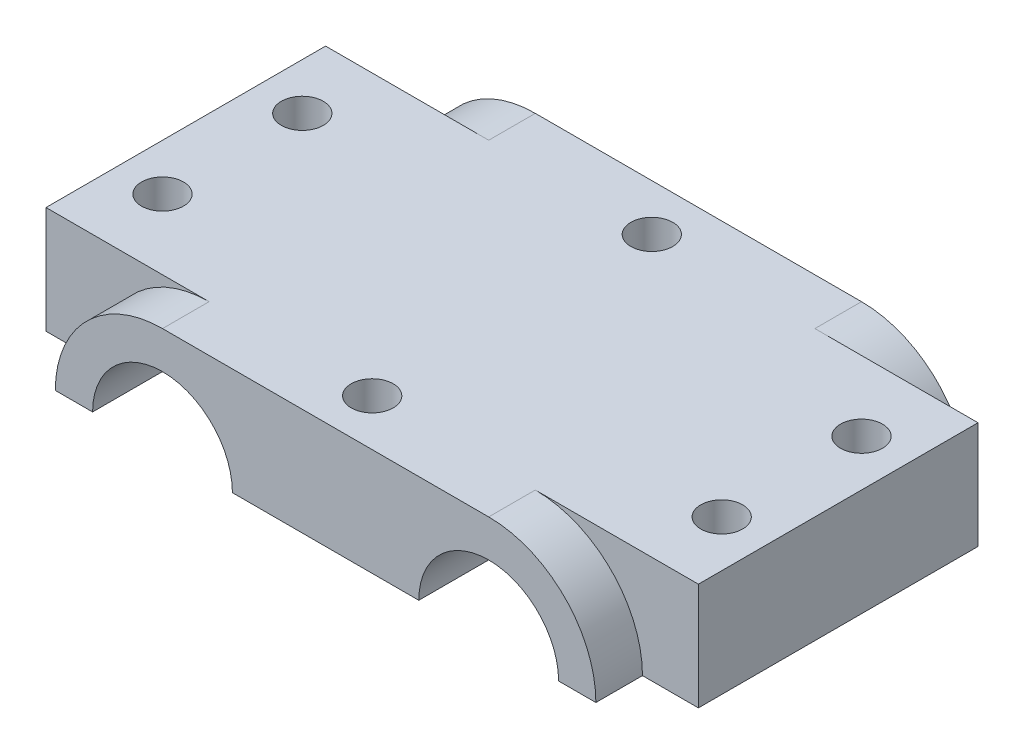
from build123d import *

# Parameters (mm, degrees)
SKETCH1_W            = 70
SKETCH1_H            = 11.5
BOSS_EXTRUDE1_DEPTH  = 20
CUT_EXTRUDE1_REACH   = 55.461
CUT_EXTRUDE2_DEPTH   = 5
HOLE1_D              = 4.5
LPATTERN1_COUNT      = 2
LPATTERN1_PITCH      = 60
LPATTERN1_COUNT_DIR2 = 2
LPATTERN1_PITCH_DIR2 = 15
HOLE2_D              = 4.5


with BuildPart() as part:
    # Sketch1 → Boss-Extrude1 (new, symmetric)
    with BuildSketch(Plane.XY):
        Rectangle(SKETCH1_W, SKETCH1_H)
    extrude(amount=BOSS_EXTRUDE1_DEPTH, both=True)

    # Sketch2 → Cut-Extrude1 (cut, up to next)
    with BuildSketch(Plane.XY.offset(20), mode=Mode.PRIVATE) as cut_extrude1_sk1:
        with BuildLine():
            Line((-25, -5.75), (-10, -5.75))
            ThreePointArc((-10, -5.75), (-17.5, 1.75), (-25, -5.75))
        make_face()
    cut_extrude1_tool1 = extrude(cut_extrude1_sk1.sketch, amount=-CUT_EXTRUDE1_REACH, mode=Mode.PRIVATE) & part.part
    # Sketch2 → Cut-Extrude1 (cut, up to next)
    with BuildSketch(Plane.XY.offset(20), mode=Mode.PRIVATE) as cut_extrude1_sk2:
        with BuildLine():
            Line((10, -5.75), (25, -5.75))
            ThreePointArc((25, -5.75), (17.5, 1.75), (10, -5.75))
        make_face()
    cut_extrude1_tool2 = extrude(cut_extrude1_sk2.sketch, amount=-CUT_EXTRUDE1_REACH, mode=Mode.PRIVATE) & part.part
    add(cut_extrude1_tool1.solids().sort_by_distance((-17.5, -2.566901, 20))[0], mode=Mode.SUBTRACT)
    add(cut_extrude1_tool2.solids().sort_by_distance((17.5, -2.566901, 20))[0], mode=Mode.SUBTRACT)

    # Sketch3 → Cut-Extrude2 (cut)
    with BuildSketch(Plane.XY.offset(20)):
        with BuildLine():
            Line((-35, 5.75), (-35, -5.75))
            Line((-35, -5.75), (-29, -5.75))
            ThreePointArc((-29, -5.75), (-25.631727984, 2.381727984), (-17.5, 5.75))
            Line((-17.5, 5.75), (-35, 5.75))
        make_face()
        with BuildLine():
            Line((29, -5.75), (35, -5.75))
            Line((35, -5.75), (35, 5.75))
            Line((35, 5.75), (17.5, 5.75))
            ThreePointArc((17.5, 5.75), (25.631727984, 2.381727984), (29, -5.75))
        make_face()
    cut_extrude2 = extrude(amount=-CUT_EXTRUDE2_DEPTH, mode=Mode.SUBTRACT)

    # Mirror1: Cut-Extrude2 across plane
    add(cut_extrude2.mirror(Plane.XY), mode=Mode.SUBTRACT)

    # Hole1 (through all)
    with Locations(Plane(origin=(0, 5.75, 0), x_dir=(1, 0, 0), z_dir=(0, 1, 0))):
        with Locations((30, -7.5)):
            hole1 = Hole(HOLE1_D / 2)

    # LPattern1: Hole1 2 × 2
    with Locations(*[(-i * LPATTERN1_PITCH, 0, -j * LPATTERN1_PITCH_DIR2) for i in range(LPATTERN1_COUNT) for j in range(LPATTERN1_COUNT_DIR2) if (i, j) != (0, 0)]):
        add(hole1, mode=Mode.SUBTRACT)

    # Hole2 (through all)
    with Locations(Plane(origin=(0, 5.75, 0), x_dir=(1, 0, 0), z_dir=(0, 1, 0))):
        with Locations((0, -15)):
            hole2 = Hole(HOLE2_D / 2)

    # Mirror2: Hole2 across plane
    add(hole2.mirror(Plane.XY), mode=Mode.SUBTRACT)


solid = part.part
